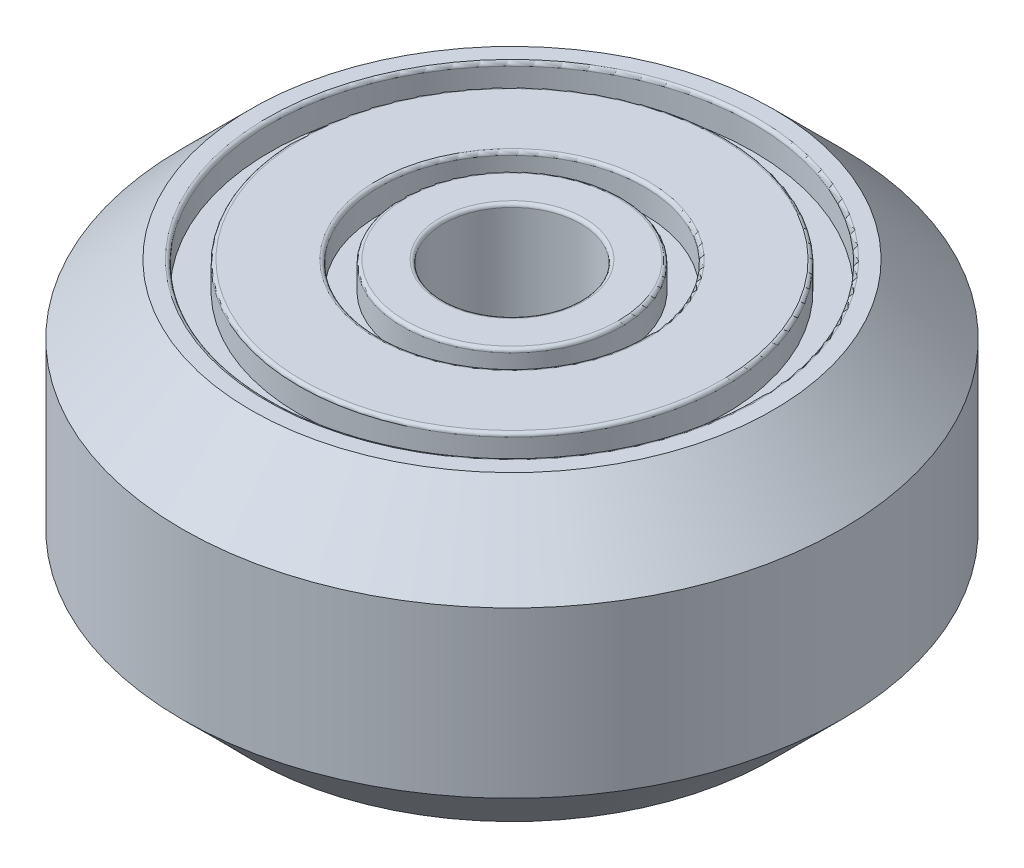
from build123d import *

# Parameters (mm, degrees)
SKETCH1_R           = 12
SKETCH1_R_2         = 2.5
BOSS_EXTRUDE1_DEPTH = 11
SKETCH3_R           = 8.795689967
SKETCH3_R_2         = 7.745486604
SKETCH3_R_3         = 4.822057037
SKETCH3_R_4         = 3.990813244
CUT_EXTRUDE1_DEPTH  = 1
CHAMFER1_SIZE       = 2.5
FILLET2_R           = 0.125


with BuildPart() as part:
    # Sketch1 → Boss-Extrude1 (new body)
    with BuildSketch(Plane(origin=(0, 0, 0), x_dir=(1, 0, 0), z_dir=(0, 1, 0))):
        with Locations(Location((0, 0, 0), (0, 0, 270))):
            Circle(SKETCH1_R)
        with Locations(Location((0, 0, 0), (0, 0, 270))):
            Circle(SKETCH1_R_2, mode=Mode.SUBTRACT)
    extrude(amount=BOSS_EXTRUDE1_DEPTH)

    # Sketch3 → Cut-Extrude1 (cut)
    # profile 1 of 2: a face of its own
    with BuildSketch(Plane(origin=(0, 11, 0), x_dir=(1, 0, 0), z_dir=(0, 1, 0))):
        with Locations(Location((0, 0, 0), (0, 0, 270))):
            Circle(SKETCH3_R)
        with Locations(Location((0, 0, 0), (0, 0, 270))):
            Circle(SKETCH3_R_2, mode=Mode.SUBTRACT)
    # profile 2 of 2: a face of its own
    with BuildSketch(Plane(origin=(0, 11, 0), x_dir=(1, 0, 0), z_dir=(0, 1, 0))):
        with Locations(Location((0, 0, 0), (0, 0, 270))):
            Circle(SKETCH3_R_3)
        with Locations(Location((0, 0, 0), (0, 0, 270))):
            Circle(SKETCH3_R_4, mode=Mode.SUBTRACT)
    cut_extrude1 = extrude(amount=-CUT_EXTRUDE1_DEPTH, mode=Mode.SUBTRACT)

    # Chamfer1
    chamfer1_edges = [part.edges().sort_by_distance(p)[0] for p in [
        (0, 0, -12),
        (0, 11, -12),
    ]]
    chamfer(chamfer1_edges, length=CHAMFER1_SIZE)

    # Fillet2
    fillet2_edges = [part.edges().sort_by_distance(p)[0] for p in [
        (0, 11, -3.990813244),
        (0, 11, -4.822057037),
        (0, 11, -7.745486604),
        (0, 11, -8.795689967),
        (0, 11, -2.5),
    ]]
    fillet(fillet2_edges, radius=FILLET2_R)

    # Mirror3: Cut-Extrude1 across plane
    add(cut_extrude1.mirror(Plane.ZX.offset(5.5)), mode=Mode.SUBTRACT)


solid = part.part
